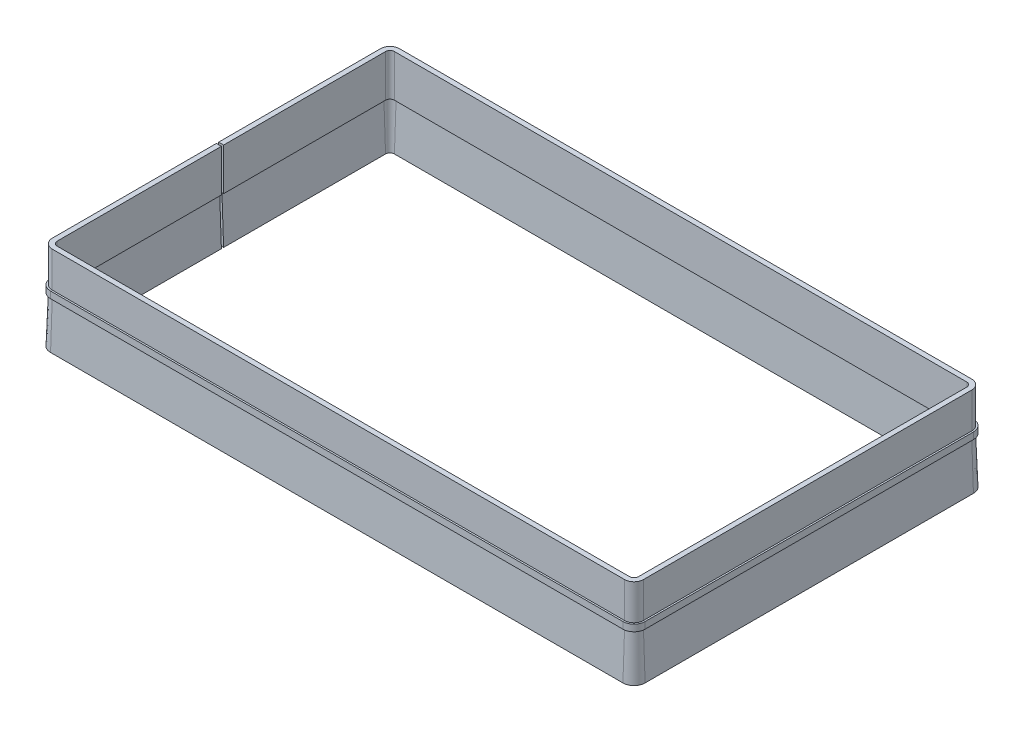
from build123d import *


with BuildPart() as part:
    # Sweep1: sweep along a path in Sketch1
    with BuildLine(Plane(origin=(0, 0, 0), x_dir=(1, 0, 0), z_dir=(0, 1, 0))) as sweep1_path:
        Line((-131, 1), (-131, 74))
        ThreePointArc((-131, 74), (-130.414213562, 75.414213562), (-129, 76))
        Line((-129, 76), (129, 76))
        ThreePointArc((129, 76), (130.414213562, 75.414213562), (131, 74))
        Line((131, 74), (131, -74))
        ThreePointArc((131, -74), (130.414213562, -75.414213562), (129, -76))
        Line((129, -76), (-129, -76))
        ThreePointArc((-129, -76), (-130.414213562, -75.414213562), (-131, -74))
        Line((-131, -74), (-131, 0))
    # Sketch2 → Sweep1 (sweep)
    with BuildSketch(Plane.XY):
        Polygon((-131, 0), (-131, -19), (-131.75, -19), (-131, -40), (-134, -40), (-133.25, -19), (-134, -19), (-134, -16), (-133.25, -16), (-133.25, 0), align=None)
    sweep(path=sweep1_path.line)


solid = part.part
